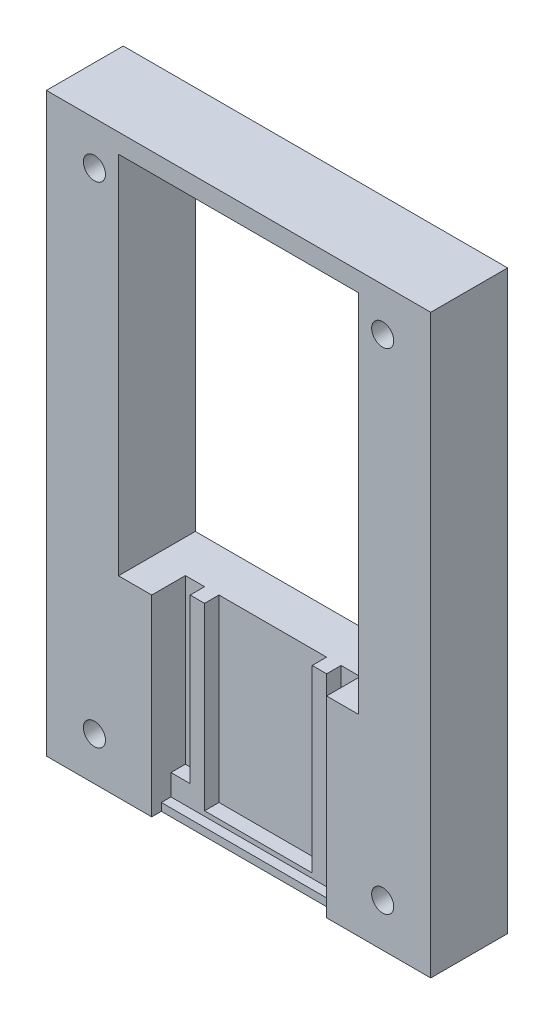
from build123d import *

# Parameters (mm, degrees)
SKETCH1_W           = 60
SKETCH1_H           = 40
BOSS_EXTRUDE1_DEPTH = 8
SKETCH3_R           = 1.15
CUT_EXTRUDE2_DEPTH  = 73.553428589
SKETCH7_W           = 25
SKETCH7_H           = 38
CUT_EXTRUDE6_DEPTH  = 73.553428589
SKETCH8_W           = 18.2
SKETCH8_H           = 45
CUT_EXTRUDE7_DEPTH  = 2
SKETCH9_W           = 2
SKETCH9_H           = 17
CUT_EXTRUDE8_DEPTH  = 1.5
SKETCH10_W          = 18.2
SKETCH10_H          = 0.8
BOSS_EXTRUDE2_DEPTH = 1
SKETCH11_W          = 11.2
SKETCH11_H          = 18.7
CUT_EXTRUDE9_DEPTH  = 1.5


with BuildPart() as part:
    # Sketch1 → Boss-Extrude1 (new body)
    with BuildSketch(Plane(origin=(0, 0, 0), x_dir=(0, 1, 0), z_dir=(0, 0, 1))):
        with Locations((30, -20)):
            Rectangle(SKETCH1_W, SKETCH1_H)
    extrude(amount=BOSS_EXTRUDE1_DEPTH)

    # Sketch3 → Cut-Extrude2 (cut, through all)
    with BuildSketch(Plane.XY.offset(8)):
        with Locations((5, 4.5)):
            Circle(SKETCH3_R)
        with Locations((35, 4.5)):
            Circle(SKETCH3_R)
        with Locations((5, 55.5)):
            Circle(SKETCH3_R)
        with Locations((35, 55.5)):
            Circle(SKETCH3_R)
    extrude(amount=-CUT_EXTRUDE2_DEPTH, mode=Mode.SUBTRACT)

    # Sketch7 → Cut-Extrude6 (cut, through all)
    with BuildSketch(Plane.XY.offset(8)):
        with Locations((20, 39)):
            Rectangle(SKETCH7_W, SKETCH7_H)
    extrude(amount=-CUT_EXTRUDE6_DEPTH, mode=Mode.SUBTRACT)

    # Sketch8 → Cut-Extrude7 (cut)
    with BuildSketch(Plane.XY.offset(8)):
        with Locations((20.062509857, 22.5)):
            Rectangle(SKETCH8_W, SKETCH8_H)
    extrude(amount=-CUT_EXTRUDE7_DEPTH, mode=Mode.SUBTRACT)

    # Sketch9 → Cut-Extrude8 (cut)
    with BuildSketch(Plane.XY.offset(6)):
        with Locations((11.962509857, 11.5)):
            Rectangle(SKETCH9_W, SKETCH9_H)
        with Locations((28.162509857, 11.5)):
            Rectangle(SKETCH9_W, SKETCH9_H)
    extrude(amount=-CUT_EXTRUDE8_DEPTH, mode=Mode.SUBTRACT)

    # Sketch10 → Boss-Extrude2 (add)
    with BuildSketch(Plane.XY.offset(6)):
        with Locations((20.062509857, 0.4)):
            Rectangle(SKETCH10_W, SKETCH10_H)
    extrude(amount=BOSS_EXTRUDE2_DEPTH)

    # Sketch11 → Cut-Extrude9 (cut)
    with BuildSketch(Plane.XY.offset(6)):
        with Locations((20.062509857, 10.65)):
            Rectangle(SKETCH11_W, SKETCH11_H)
    extrude(amount=-CUT_EXTRUDE9_DEPTH, mode=Mode.SUBTRACT)


solid = part.part
